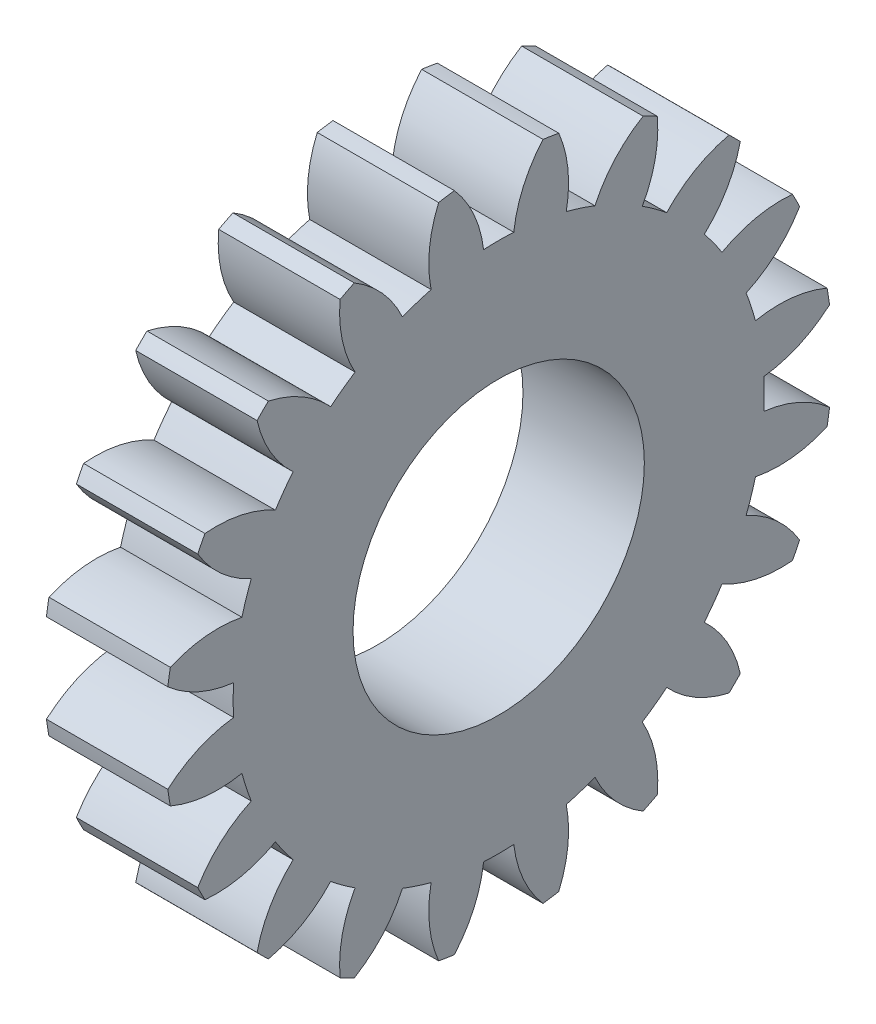
from build123d import *

# Parameters (mm, degrees)
BASPROSKE_W     = 5
BASPROSKE_H     = 13.75
TOOTHCUT_DEPTH  = 21.077973005
TEETHCUTS_COUNT = 20
TEETHCUTS_ANGLE = 342
BORSKE_R        = 6
BORE_DEPTH      = 50.0000508


with BuildPart() as part:
    # BasProSke → Base-Revolve (revolve)
    with BuildSketch(Plane(origin=(0, 0, 0), x_dir=(1, 0, 0), z_dir=(0, 1, 0)), mode=Mode.PRIVATE) as base_revolve_sk:
        with Locations((2.5, 6.875)):
            Rectangle(BASPROSKE_W, BASPROSKE_H)
    revolve(base_revolve_sk.sketch.rotate(Axis((-10, 0, 0), (1, 0, 0)), 180), axis=Axis((-10, 0, 0), (1, 0, 0)))

    # TooCutSke → ToothCut (cut, through all)
    with BuildSketch(Plane(origin=(0, 0, 0), x_dir=(0, 0, -1), z_dir=(1, 0, 0))):
        with BuildLine():
            ThreePointArc((0.62110296, 10.918848994), (0, 10.9365), (-0.62110296, 10.918848994))
            ThreePointArc((-0.62110296, 10.918848994), (-1.024517052, 12.378857135), (-1.846615859, 13.651067908))
            ThreePointArc((-1.846615859, 13.651067908), (0, 13.7754), (1.846615859, 13.651067908))
            ThreePointArc((1.846615859, 13.651067908), (1.024517052, 12.378857135), (0.62110296, 10.918848994))
        make_face()
    toothcut = extrude(amount=TOOTHCUT_DEPTH, mode=Mode.SUBTRACT)

    # TeethCuts: ToothCut ×20 about axis
    teethcuts_axis = Axis((-10, 0, 0), (1, 0, 0))
    for i in range(1, TEETHCUTS_COUNT):
        add(toothcut.rotate(teethcuts_axis, i * TEETHCUTS_ANGLE / (TEETHCUTS_COUNT - 1)), mode=Mode.SUBTRACT)

    # BorSke → Bore (cut, symmetric)
    with BuildSketch(Plane(origin=(0, 0, 0), x_dir=(0, 0, -1), z_dir=(1, 0, 0))):
        with Locations(Location((0, 0, 0), (0, 0, 180))):
            Circle(BORSKE_R)
    extrude(amount=BORE_DEPTH, both=True, mode=Mode.SUBTRACT)


solid = part.part
